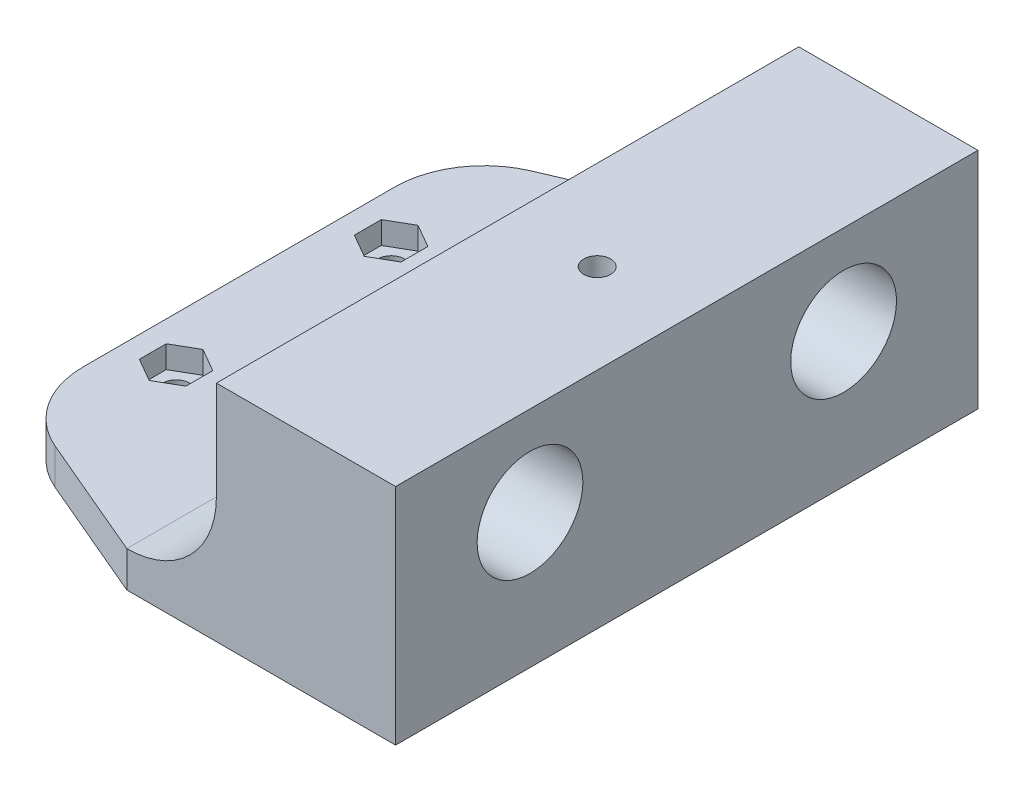
from build123d import *

# Parameters (mm, degrees)
BOSS_EXTRUDE1_DEPTH     = 32.5
CUT_EXTRUDE1_DEPTH      = 65.662585782
CUT_EXTRUDE1_DEPTH_BACK = 65.662585782
SKETCH2_R               = 5.9
CUT_EXTRUDE2_DEPTH      = 58.282196244
CUT_EXTRUDE2_DEPTH_BACK = 58.282196244
SKETCH3_R               = 1.5
CUT_EXTRUDE3_DEPTH      = 58.282196244
CUT_EXTRUDE3_DEPTH_BACK = 58.282196244
SKETCH4_R               = 1.5
CUT_EXTRUDE4_DEPTH      = 2.5
CUT_EXTRUDE5_DEPTH      = 56.652942478
CUT_EXTRUDE5_DEPTH_BACK = 56.652942478
FILLET1_R               = 10


with BuildPart() as part:
    # Sketch1 → Boss-Extrude1 (new, symmetric)
    with BuildSketch(Plane.XY):
        with BuildLine():
            Line((-40, 0), (-40, 4))
            Line((-40, 4), (-20, 4))
            ThreePointArc((-20, 4), (-12.928932188, 6.928932188), (-10, 14))
            Line((-10, 14), (-10, 25))
            Line((-10, 25), (10, 25))
            Line((10, 25), (10, 14))
            Line((10, 14), (10, 0))
            Line((10, 0), (-40, 0))
        make_face()
    extrude(amount=BOSS_EXTRUDE1_DEPTH, both=True)

    # Sketch2 → Cut-Extrude1 (cut, two sides: drawn at the far end of the back side and taken through both)
    with BuildSketch(Plane(origin=(10, 0, 0), x_dir=(0, 0, -1), z_dir=(1, 0, 0)).offset(-CUT_EXTRUDE1_DEPTH_BACK)):
        with Locations(Location((-17.5, 15, 0), (0, 0, 350.241743405))):
            Circle(SKETCH2_R)
        with Locations(Location((17.5, 15, 0), (0, 0, 350.241743405))):
            Circle(SKETCH2_R)
    extrude(amount=CUT_EXTRUDE1_DEPTH + CUT_EXTRUDE1_DEPTH_BACK, mode=Mode.SUBTRACT)

    # Sketch3 → Cut-Extrude2 (cut, two sides: drawn at the far end of the back side and taken through both)
    with BuildSketch(Plane.XZ.offset(-CUT_EXTRUDE2_DEPTH_BACK)):
        with Locations((-35, 12)):
            Circle(SKETCH3_R)
        with Locations((-35, -12)):
            Circle(SKETCH3_R)
    extrude(amount=CUT_EXTRUDE2_DEPTH + CUT_EXTRUDE2_DEPTH_BACK, mode=Mode.SUBTRACT)

    # Sketch4 → Cut-Extrude3 (cut, two sides: drawn at the far end of the back side and taken through both)
    with BuildSketch(Plane(origin=(0, 25, 0), x_dir=(1, 0, 0), z_dir=(0, 1, 0)).offset(-CUT_EXTRUDE3_DEPTH_BACK)):
        with Locations(Location((0, 0, 0), (0, 0, 270))):
            Circle(SKETCH4_R)
    extrude(amount=CUT_EXTRUDE3_DEPTH + CUT_EXTRUDE3_DEPTH_BACK, mode=Mode.SUBTRACT)

    # Sketch5 → Cut-Extrude4 (cut)
    with BuildSketch(Plane(origin=(0, 4, 0), x_dir=(1, 0, 0), z_dir=(0, 1, 0))):
        Polygon((-32.401923789, -10.5), (-35, -9), (-37.598076211, -10.5), (-37.598076211, -13.5), (-35, -15), (-32.401923789, -13.5), align=None)
        Polygon((-32.401923789, 10.5), (-32.401923789, 13.5), (-35, 15), (-37.598076211, 13.5), (-37.598076211, 10.5), (-35, 9), align=None)
    extrude(amount=-CUT_EXTRUDE4_DEPTH, mode=Mode.SUBTRACT)

    # Sketch6 → Cut-Extrude5 (cut, two sides: drawn at the far end of the back side and taken through both)
    with BuildSketch(Plane(origin=(0, 4, 0), x_dir=(1, 0, 0), z_dir=(0, 1, 0)).offset(-CUT_EXTRUDE5_DEPTH_BACK)):
        Polygon((-20, -32.5), (-40, -24), (-40, -32.5), align=None)
        Polygon((-20, 32.5), (-40, 24), (-40, 32.5), align=None)
    extrude(amount=CUT_EXTRUDE5_DEPTH + CUT_EXTRUDE5_DEPTH_BACK, mode=Mode.SUBTRACT)

    # Fillet1
    fillet1_edges = [part.edges().sort_by_distance(p)[0] for p in [
        (-40, 2, 24),
        (-40, 2, -24),
    ]]
    fillet(fillet1_edges, radius=FILLET1_R)


solid = part.part
